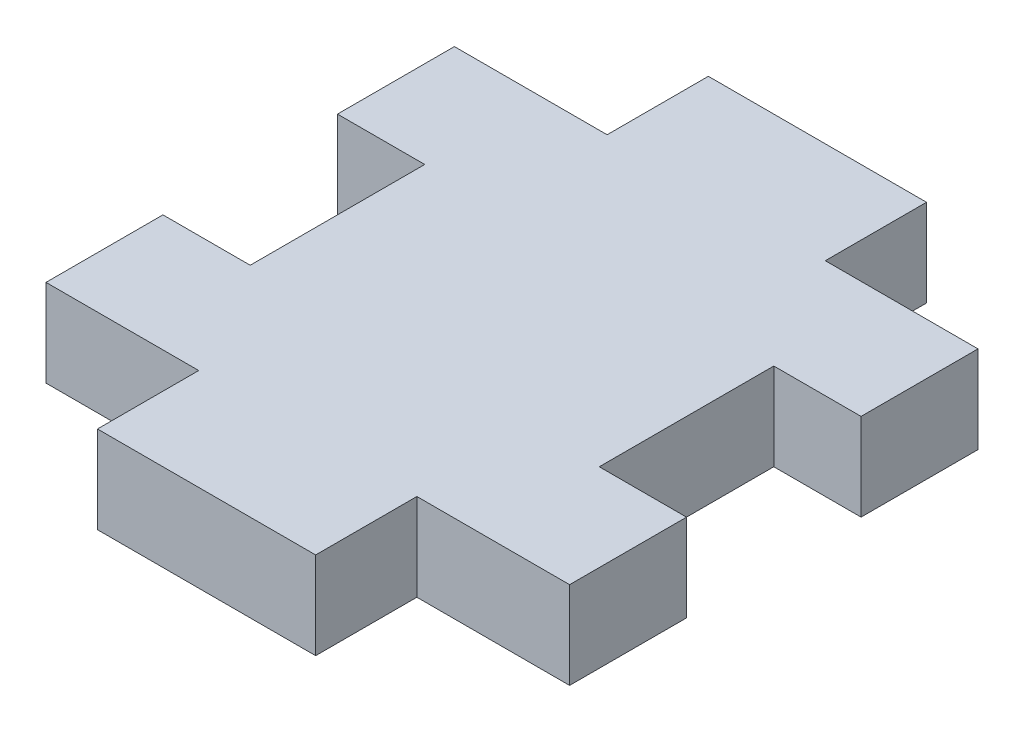
from build123d import *

# Parameters (mm, degrees)
BOSS_EXTRUDE1_DEPTH = 12.7


with BuildPart() as part:
    # Sketch1 → Boss-Extrude1 (new body)
    with BuildSketch(Plane(origin=(0, 0, 0), x_dir=(1, 0, 0), z_dir=(0, 1, 0))):
        Polygon((-15.875, -29.718), (-38.1, -29.718), (-38.1, -12.7), (-25.4, -12.7), (-25.4, 12.7), (-38.1, 12.7), (-38.1, 29.718), (-15.875, 29.718), (-15.875, 44.45), (15.875, 44.45), (15.875, 29.718), (38.1, 29.718), (38.1, 12.7), (25.4, 12.7), (25.4, -12.7), (38.1, -12.7), (38.1, -29.718), (15.875, -29.718), (15.875, -44.45), (-15.875, -44.45), align=None)
    extrude(amount=BOSS_EXTRUDE1_DEPTH)


solid = part.part
